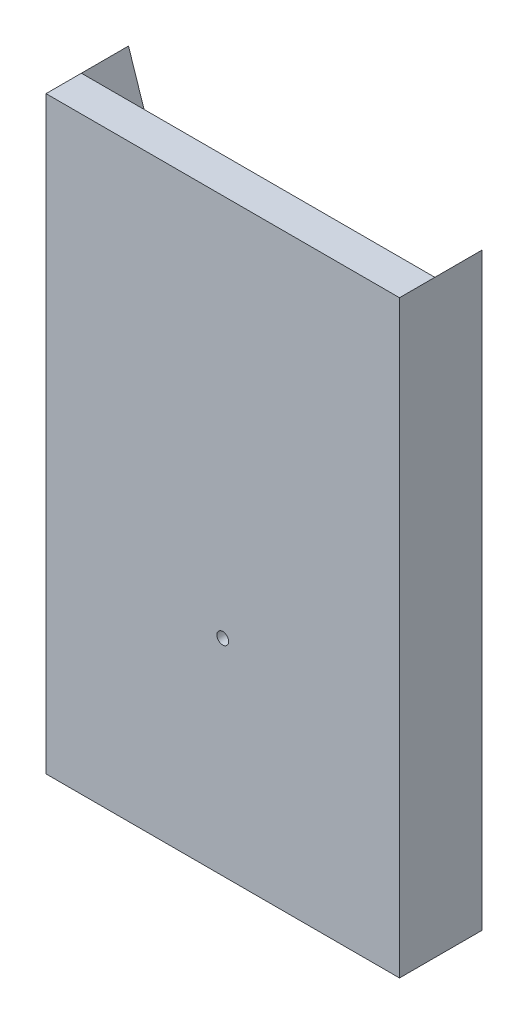
from build123d import *

# Parameters (mm, degrees)
SKETCH_1_W          = 150
SKETCH_1_H          = 250
EXTRUDE_1_DEPTH     = 35
CUT_EXTRUDE_1_DEPTH = 20
SKETCH_3_R          = 2.5
CUT_EXTRUDE_2_DEPTH = 293.232783924


with BuildPart() as part:
    # Эскиз1 → Бобышка-Вытянуть1 (new body)
    with BuildSketch(Plane.XY):
        with Locations((75, -125)):
            Rectangle(SKETCH_1_W, SKETCH_1_H)
    extrude(amount=EXTRUDE_1_DEPTH)

    # Эскиз2 → Вырез-Вытянуть1 (cut)
    with BuildSketch(Plane.XY):
        with BuildLine():
            Line((0, 0), (44.994645372, -136.185163226))
            ThreePointArc((44.994645372, -136.185163226), (35, -162.636603521), (44.994645372, -189.088043815))
            Line((44.994645372, -189.088043815), (0, -250))
            Line((0, -250), (150, -250))
            Line((150, -250), (105.005354628, -189.088043815))
            ThreePointArc((105.005354628, -189.088043815), (115, -162.636603521), (105.005354628, -136.185163226))
            Line((105.005354628, -136.185163226), (150, 0))
            Line((150, 0), (0, 0))
        make_face()
    extrude(amount=CUT_EXTRUDE_1_DEPTH, mode=Mode.SUBTRACT)

    # Эскиз3 → Вырез-Вытянуть2 (cut, through all)
    with BuildSketch(Plane(origin=(0, 0, 20), x_dir=(-1, 0, 0), z_dir=(0, 0, -1))):
        with Locations((-75, -162.636603521)):
            Circle(SKETCH_3_R)
    extrude(amount=-CUT_EXTRUDE_2_DEPTH, mode=Mode.SUBTRACT)


solid = part.part
